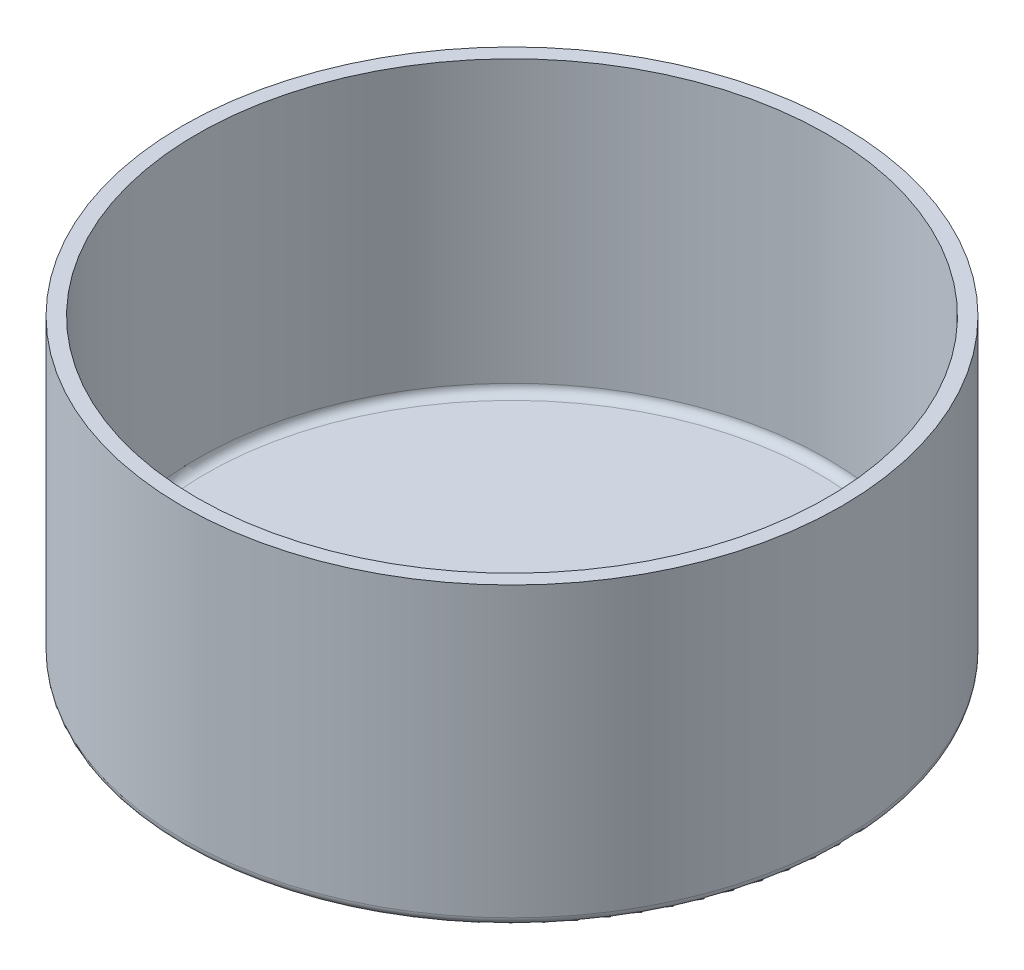
from build123d import *

# Parameters (mm, degrees)
CROQUIS1_R              = 11.375
SALIENTE_EXTRUIR1_DEPTH = 0.25
CROQUIS2_R              = 11.375
CROQUIS2_R_2            = 10.875
SALIENTE_EXTRUIR2_DEPTH = 10
REDONDEO1_R             = 0.3
REDONDEO2_R             = 0.3


with BuildPart() as part:
    # Croquis1 → Saliente-Extruir1 (new body)
    with BuildSketch(Plane(origin=(0, 0, 0), x_dir=(1, 0, 0), z_dir=(0, 1, 0))):
        with Locations(Location((0, 0, 0), (0, 0, 270))):
            Circle(CROQUIS1_R)
    extrude(amount=SALIENTE_EXTRUIR1_DEPTH)

    # Croquis2 → Saliente-Extruir2 (add)
    with BuildSketch(Plane(origin=(0, 0.25, 0), x_dir=(1, 0, 0), z_dir=(0, 1, 0))):
        with Locations(Location((0, 0, 0), (0, 0, 270))):
            Circle(CROQUIS2_R)
        with Locations(Location((0, 0, 0), (0, 0, 270))):
            Circle(CROQUIS2_R_2, mode=Mode.SUBTRACT)
    extrude(amount=SALIENTE_EXTRUIR2_DEPTH)

    # Redondeo1
    redondeo1_edges = [part.edges().sort_by_distance(p)[0] for p in [
        (0, 0.25, -10.875),
    ]]
    fillet(redondeo1_edges, radius=REDONDEO1_R)

    # Redondeo2
    redondeo2_edges = [part.edges().sort_by_distance(p)[0] for p in [
        (0, 0, -11.375),
    ]]
    fillet(redondeo2_edges, radius=REDONDEO2_R)


solid = part.part
